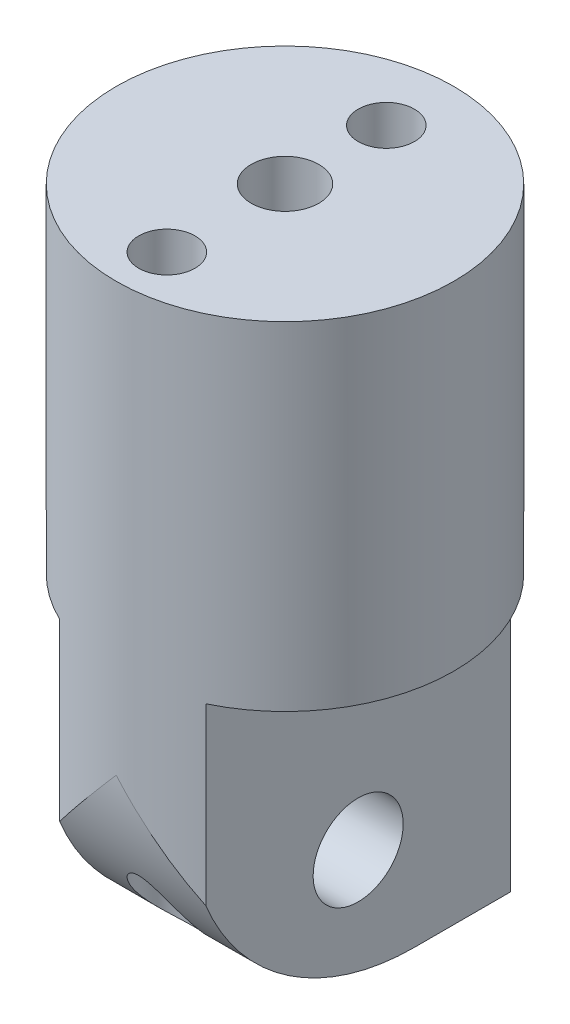
from build123d import *
from build123d.topology import SkipClean

# Parameters (mm, degrees)
SKETCH1_W           = 6.5
SKETCH1_H           = 14
BOSS_EXTRUDE1_DEPTH = 15
FILLET1_R           = 10
SKETCH2_R           = 2
CUT_EXTRUDE1_DEPTH  = 18.783419244
SKETCH4_R           = 7.5
BOSS_EXTRUDE2_DEPTH = 15
SKETCH6_W           = 7
SKETCH6_H           = 12.68
CUT_EXTRUDE2_DEPTH  = 28.663152387
CUT_EXTRUDE3_DEPTH  = 23.5
SKETCH11_R          = 1.25
CUT_EXTRUDE7_DEPTH  = 24
BOSS_EXTRUDE3_START = 12.68
SKETCH12_R          = 1.25
BOSS_EXTRUDE3_DEPTH = 12.68
SKETCH13_R          = 1.5
CUT_EXTRUDE8_DEPTH  = 6


with BuildPart() as part:
    # Sketch1 → Boss-Extrude1 (new body)
    with BuildSketch(Plane.XY):
        Rectangle(SKETCH1_W, SKETCH1_H)
    extrude(amount=BOSS_EXTRUDE1_DEPTH)

    # Fillet1
    fillet1_edges = [part.edges().sort_by_distance(p)[0] for p in [
        (0, -7, 15),
    ]]
    fillet(fillet1_edges, radius=FILLET1_R)

    # Sketch2 → Cut-Extrude1 (cut, through all)
    with BuildSketch(Plane(origin=(3.25, 0, 0), x_dir=(0, 0, -1), z_dir=(1, 0, 0))):
        with Locations(Location((-7.5, -2, 0), (0, 0, 90))):
            Circle(SKETCH2_R)
    extrude(amount=-CUT_EXTRUDE1_DEPTH, mode=Mode.SUBTRACT)

    # Sketch4 → Boss-Extrude2 (add)
    with BuildSketch(Plane(origin=(0, 7, 0), x_dir=(1, 0, 0), z_dir=(0, 1, 0))):
        with Locations(Location((0, -7.5, 0), (0, 0, 270))):
            Circle(SKETCH4_R)
    extrude(amount=BOSS_EXTRUDE2_DEPTH)

    # Sketch6 → Cut-Extrude2 (cut, through all)
    with BuildSketch(Plane(origin=(0, 0, 0), x_dir=(-1, 0, 0), z_dir=(0, 0, -1))):
        with Locations((0, 15.66)):
            Rectangle(SKETCH6_W, SKETCH6_H)
    extrude(amount=-CUT_EXTRUDE2_DEPTH, mode=Mode.SUBTRACT)

    # Sketch7 → Cut-Extrude3 (cut, through all)
    with BuildSketch(Plane(origin=(0, 7, 0), x_dir=(1, 0, 0), z_dir=(0, 1, 0))):
        with BuildLine():
            ThreePointArc((0, -15), (-1.666673801, -14.812468697), (-3.25, -14.259252917))
            Line((-3.25, -14.259252917), (-3.25, -15))
            Line((-3.25, -15), (0, -15))
        make_face()
        with BuildLine():
            ThreePointArc((3.25, -14.259252917), (1.666673801, -14.812468697), (0, -15))
            Line((0, -15), (3.25, -15))
            Line((3.25, -15), (3.25, -14.259252917))
        make_face()
        with BuildLine():
            ThreePointArc((-3.25, -0.740747083), (-1.666673801, -0.187531303), (0, 0))
            Line((0, 0), (-3.25, 0))
            Line((-3.25, 0), (-3.25, -0.740747083))
        make_face()
        with BuildLine():
            Line((3.25, 0), (0, 0))
            ThreePointArc((0, 0), (1.666673801, -0.187531303), (3.25, -0.740747083))
            Line((3.25, -0.740747083), (3.25, 0))
        make_face()
    extrude(amount=-CUT_EXTRUDE3_DEPTH, mode=Mode.SUBTRACT)

    # Sketch11 → Cut-Extrude7 (cut)
    with BuildSketch(Plane.XZ.offset(7)):
        with Locations(Location((0, 12.74882624, 0), (0, 0, 270))):
            Circle(SKETCH11_R)
        with Locations(Location((0, 3, 0), (0, 0, 270))):
            Circle(SKETCH11_R)
    extrude(amount=-CUT_EXTRUDE7_DEPTH, mode=Mode.SUBTRACT)

    # Sketch12 → Boss-Extrude3 (add)
    with SkipClean():  # the faces are left unmerged after this step: merging them gives an invalid solid
        with BuildSketch(Plane(origin=(0, 9.32, 0), x_dir=(1, 0, 0), z_dir=(0, 1, 0)).offset(BOSS_EXTRUDE3_START)):
            with BuildLine():
                Line((3.5, -14.133249581), (3.5, -0.866750419))
                ThreePointArc((3.5, -0.866750419), (0, 0), (-3.5, -0.866750419))
                Line((-3.5, -0.866750419), (-3.5, -14.133249581))
                ThreePointArc((-3.5, -14.133249581), (0, -15), (3.5, -14.133249581))
            make_face()
            with Locations(Location((0, -3, 0), (0, 0, 90))):
                Circle(SKETCH12_R, mode=Mode.SUBTRACT)
            with Locations(Location((0, -12.74882624, 0), (0, 0, 90))):
                Circle(SKETCH12_R, mode=Mode.SUBTRACT)
        extrude(amount=-BOSS_EXTRUDE3_DEPTH)

    # Sketch13 → Cut-Extrude8 (cut)
    with SkipClean():  # the faces are left unmerged after this step: merging them gives an invalid solid
        with BuildSketch(Plane(origin=(0, 22, 0), x_dir=(1, 0, 0), z_dir=(0, 1, 0))):
            with Locations(Location((0, -7.5, 0), (0, 0, 270))):
                Circle(SKETCH13_R)
        extrude(amount=-CUT_EXTRUDE8_DEPTH, mode=Mode.SUBTRACT)


solid = part.part
